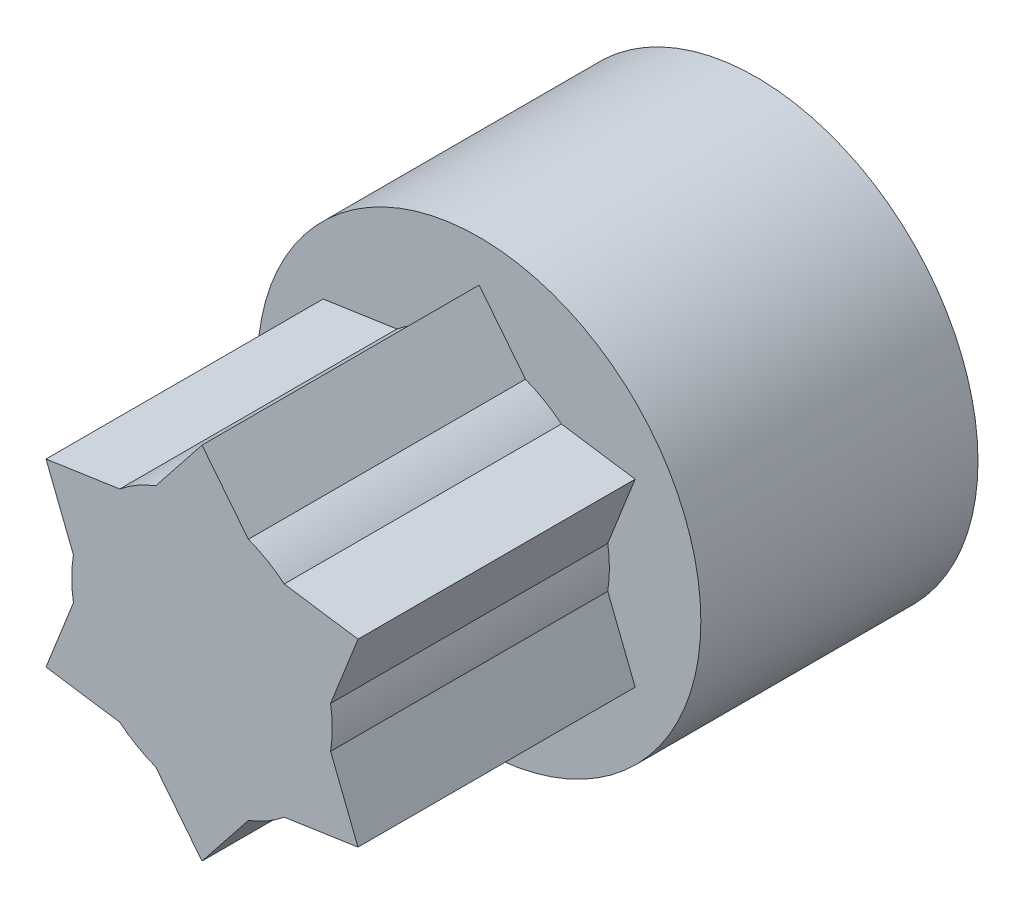
from build123d import *

# Parameters (mm, degrees)
SKETCH_2_R      = 2.35
EXTRUDE_2_DEPTH = 5
SKETCH_3_R      = 4
EXTRUDE_4_DEPTH = 5


with BuildPart() as part:
    # Эскиз2 → Бобышка-Вытянуть2 (new body)
    with BuildSketch(Plane.XY.offset(31.602998)):
        Circle(SKETCH_2_R)
        with BuildLine():
            Line((0, 3.25), (-0.83598392, 2.196276596))
            ThreePointArc((-0.83598392, 2.196276596), (0, 2.35), (0.83598392, 2.196276596))
            Line((0.83598392, 2.196276596), (0, 3.25))
        make_face()
        with BuildLine():
            Line((2.814582562, 1.625), (1.484039366, 1.82212161))
            ThreePointArc((1.484039366, 1.82212161), (2.035159699, 1.175), (2.320023286, 0.374154986))
            Line((2.320023286, 0.374154986), (2.814582562, 1.625))
        make_face()
        with BuildLine():
            Line((2.814582562, -1.625), (2.320023286, -0.374154986))
            ThreePointArc((2.320023286, -0.374154986), (2.035159699, -1.175), (1.484039366, -1.82212161))
            Line((1.484039366, -1.82212161), (2.814582562, -1.625))
        make_face()
        with BuildLine():
            ThreePointArc((0.83598392, -2.196276596), (0, -2.35), (-0.83598392, -2.196276596))
            Line((-0.83598392, -2.196276596), (0, -3.25))
            Line((0, -3.25), (0.83598392, -2.196276596))
        make_face()
        with BuildLine():
            ThreePointArc((-1.484039366, -1.82212161), (-2.035159699, -1.175), (-2.320023286, -0.374154986))
            Line((-2.320023286, -0.374154986), (-2.814582562, -1.625))
            Line((-2.814582562, -1.625), (-1.484039366, -1.82212161))
        make_face()
        with BuildLine():
            ThreePointArc((-2.320023286, 0.374154986), (-2.035159699, 1.175), (-1.484039366, 1.82212161))
            Line((-1.484039366, 1.82212161), (-2.814582562, 1.625))
            Line((-2.814582562, 1.625), (-2.320023286, 0.374154986))
        make_face()
    extrude(amount=EXTRUDE_2_DEPTH)

    # Эскиз3 → Бобышка-Вытянуть4 (add)
    with BuildSketch(Plane.XY.offset(31.602998)):
        Circle(SKETCH_3_R)
    extrude(amount=-EXTRUDE_4_DEPTH)


solid = part.part
